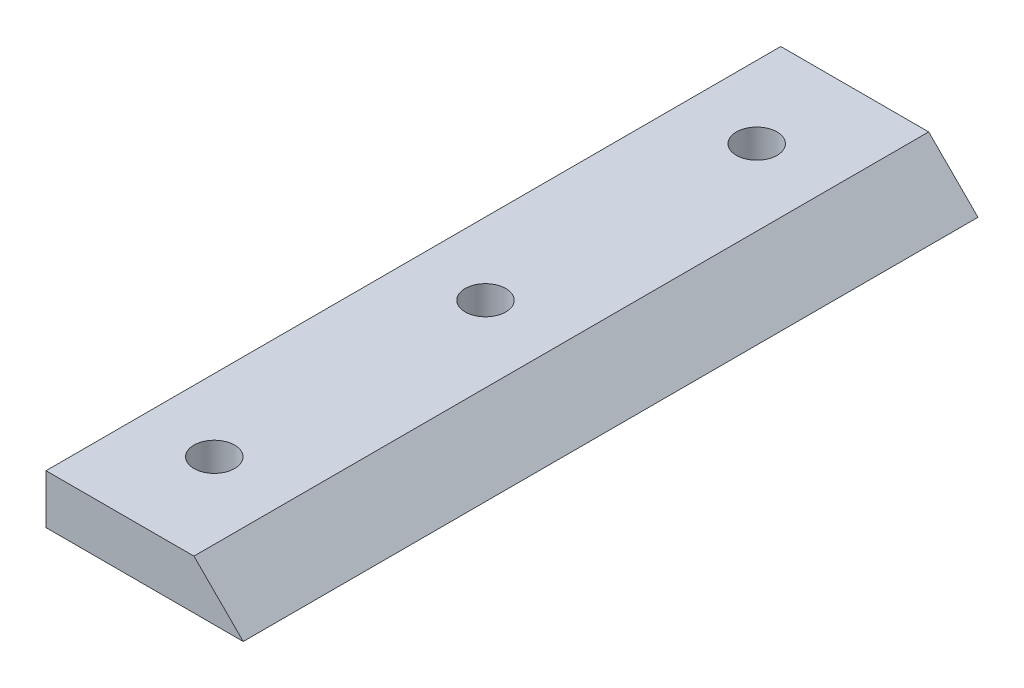
from build123d import *

# Parameters (mm, degrees)
BOSS_EXTRUDE1_DEPTH = 74.5
SKETCH2_R           = 4.125
CUT_EXTRUDE1_DEPTH  = 78.783352975


with BuildPart() as part:
    # Sketch1 → Boss-Extrude1 (new, symmetric)
    with BuildSketch(Plane.XY):
        Polygon((-20, 10), (10, 10), (20, 0), (-20, 0), align=None)
    extrude(amount=BOSS_EXTRUDE1_DEPTH, both=True)

    # Sketch2 → Cut-Extrude1 (cut, through all)
    with BuildSketch(Plane(origin=(0, 10, 0), x_dir=(1, 0, 0), z_dir=(0, 1, 0))):
        with Locations(Location((-5.375, 0, 0), (0, 0, 180))):
            Circle(SKETCH2_R)
        with Locations(Location((-5.375, -55, 0), (0, 0, 180))):
            Circle(SKETCH2_R)
        with Locations((-5.375, 55)):
            Circle(SKETCH2_R)
    extrude(amount=-CUT_EXTRUDE1_DEPTH, mode=Mode.SUBTRACT)


solid = part.part
